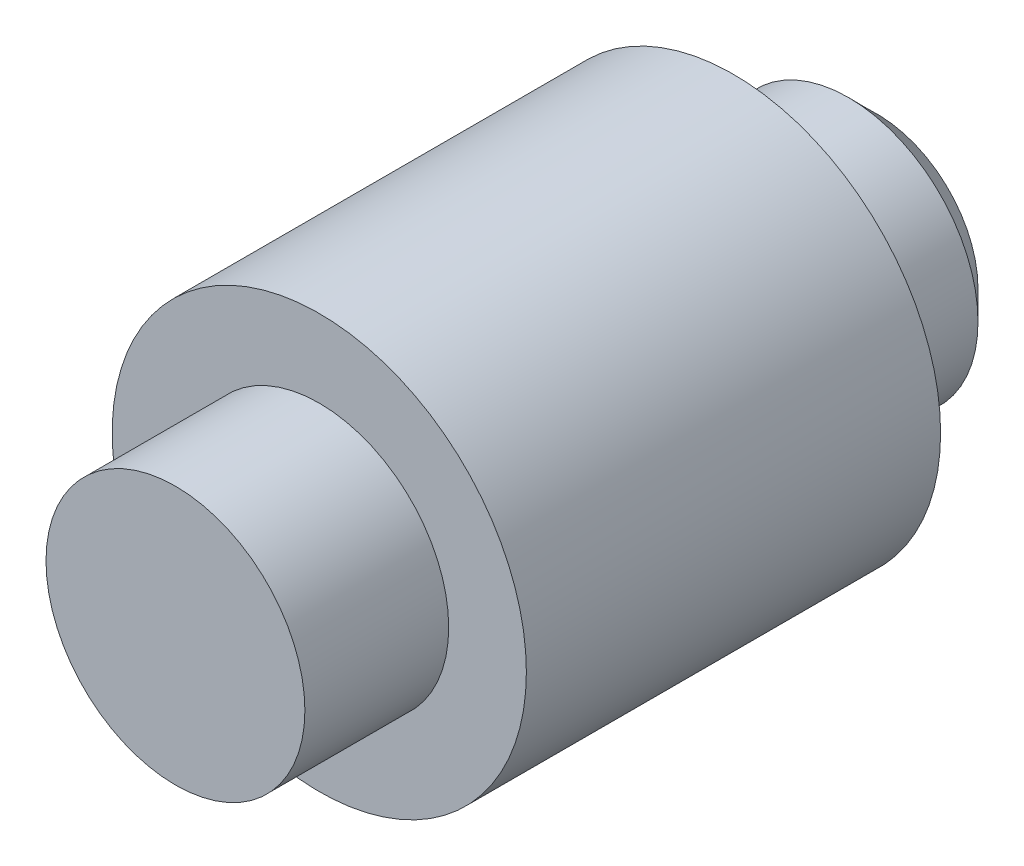
from build123d import *

# Parameters (mm, degrees)
SKETCH3_R           = 3.6
BOSS_EXTRUDE1_DEPTH = 7.2
SKETCH4_R           = 2.25
BOSS_EXTRUDE2_DEPTH = 2.5
BOSS_EXTRUDE3_START = 2.5
SKETCH5_R           = 2.25
BOSS_EXTRUDE3_DEPTH = 2.5
CHAMFER1_SIZE       = 0.5


with BuildPart() as part:
    # Sketch3 → Boss-Extrude1 (new body)
    with BuildSketch(Plane.XY):
        Circle(SKETCH3_R)
    extrude(amount=BOSS_EXTRUDE1_DEPTH)

    # Sketch4 → Boss-Extrude2 (add)
    with BuildSketch(Plane.XY):
        Circle(SKETCH4_R)
    extrude(amount=-BOSS_EXTRUDE2_DEPTH)

    # Sketch5 → Boss-Extrude3 (add)
    with BuildSketch(Plane.XY.offset(7.2).offset(BOSS_EXTRUDE3_START)):
        Circle(SKETCH5_R)
    extrude(amount=-BOSS_EXTRUDE3_DEPTH)

    # Chamfer1
    chamfer1_edges = [part.edges().sort_by_distance(p)[0] for p in [
        (-2.25, 0, -2.5),
    ]]
    chamfer(chamfer1_edges, length=CHAMFER1_SIZE)


solid = part.part
